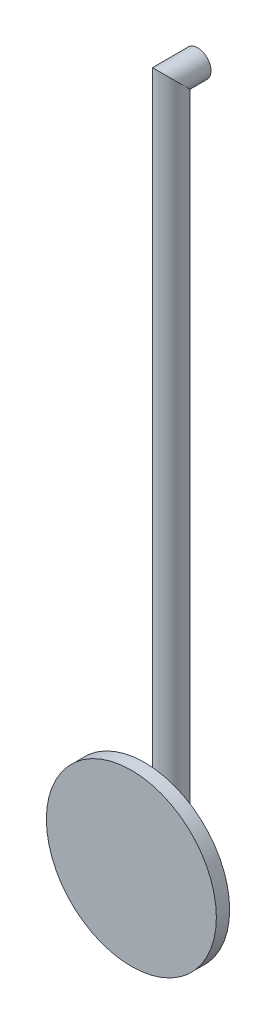
from build123d import *

# Parameters (mm, degrees)
SKETCH_1_R      = 32
EXTRUDE_2_DEPTH = 5
SKETCH_5_R      = 5


with BuildPart() as part:
    # 草图1 → 凸台-拉伸2 (new body)
    with BuildSketch(Plane.XY):
        Circle(SKETCH_1_R)
    extrude(amount=-EXTRUDE_2_DEPTH)

    # 扫描1: sweep along a path in 草图2
    with BuildLine(Plane(origin=(0, 0, 0), x_dir=(0, 0, -1), z_dir=(1, 0, 0))) as sweep_1_path:
        Line((5, 0), (15, 0))
        Line((15, 0), (15, 250))
        Line((15, 250), (25, 250))
    # 草图5 → 扫描1 (sweep)
    with BuildSketch(Plane.XY.offset(-5)):
        Circle(SKETCH_5_R)
    sweep(path=sweep_1_path.line, transition=Transition.RIGHT)


solid = part.part
